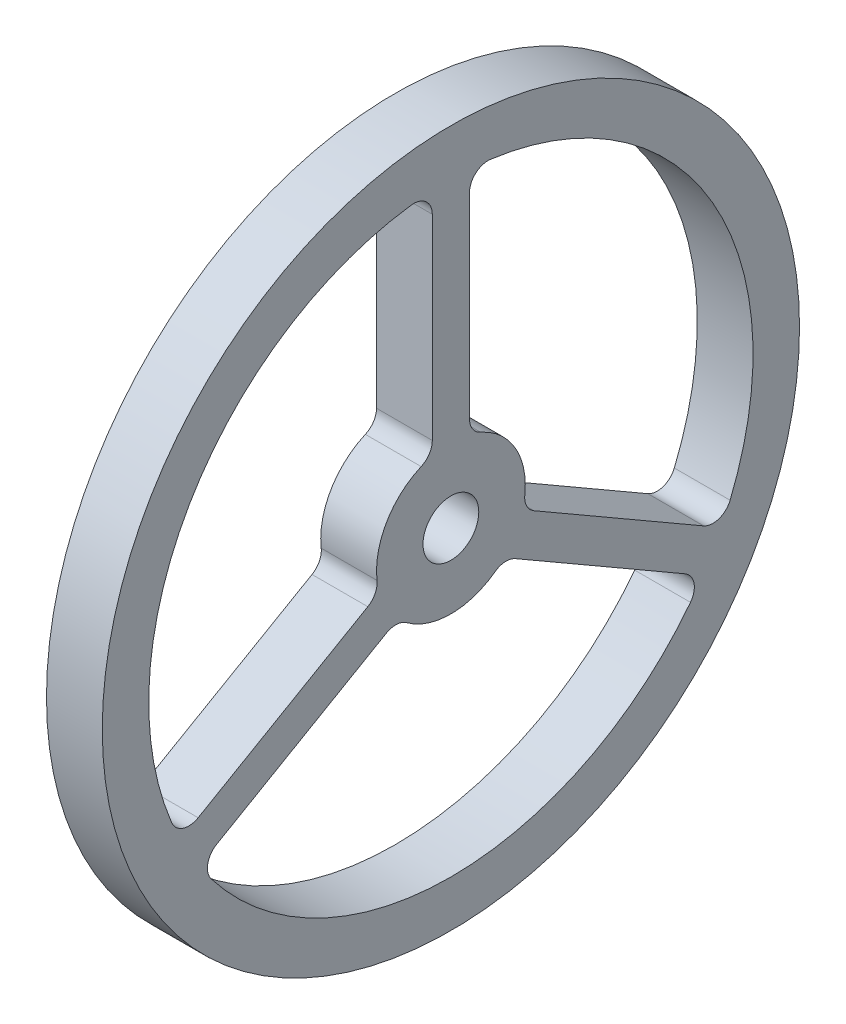
from build123d import *

# Parameters (mm, degrees)
SKETCH1_R           = 37.5
SKETCH1_R_2         = 3
BOSS_EXTRUDE1_DEPTH = 6
FILLET1_R           = 2


with BuildPart() as part:
    # Sketch1 → Boss-Extrude1 (new body)
    with BuildSketch(Plane(origin=(0, 0, 0), x_dir=(0, 0, -1), z_dir=(1, 0, 0))):
        Circle(SKETCH1_R)
        with BuildLine():
            ThreePointArc((-2, 7.745966692), (-6.92820323, 4), (-7.708203932, -2.140932539))
            Line((-7.708203932, -2.140932539), (-29.0924812, -14.487150776))
            ThreePointArc((-29.0924812, -14.487150776), (-28.145825623, 16.25), (-2, 32.438403167))
            Line((-2, 32.438403167), (-2, 7.745966692))
        make_face(mode=Mode.SUBTRACT)
        Circle(SKETCH1_R_2, mode=Mode.SUBTRACT)
        with BuildLine():
            ThreePointArc((-5.708203932, -5.605034154), (0, -8), (5.708203933, -5.605034154))
            Line((5.708203933, -5.605034154), (27.0924812, -17.951252391))
            ThreePointArc((27.0924812, -17.951252391), (0, -32.5), (-27.0924812, -17.951252391))
            Line((-27.0924812, -17.951252391), (-5.708203932, -5.605034154))
        make_face(mode=Mode.SUBTRACT)
        with BuildLine():
            ThreePointArc((7.708203933, -2.140932539), (6.92820323, 4), (2, 7.745966692))
            Line((2, 7.745966692), (2, 32.438403167))
            ThreePointArc((2, 32.438403167), (28.145825623, 16.25), (29.0924812, -14.487150776))
            Line((29.0924812, -14.487150776), (7.708203933, -2.140932539))
        make_face(mode=Mode.SUBTRACT)
    extrude(amount=BOSS_EXTRUDE1_DEPTH)

    # Fillet1
    fillet1_edges = [part.edges().sort_by_distance(p)[0] for p in [
        (3, 32.438403167, 2),
        (3, -14.487150776, 29.0924812),
        (3, -2.140932539, 7.708203932),
        (3, 7.745966692, 2),
        (3, -17.951252391, 27.0924812),
        (3, -17.951252391, -27.0924812),
        (3, -5.605034154, -5.708203933),
        (3, -5.605034154, 5.708203932),
        (3, -14.487150776, -29.0924812),
        (3, 32.438403167, -2),
        (3, 7.745966692, -2),
        (3, -2.140932539, -7.708203933),
    ]]
    fillet(fillet1_edges, radius=FILLET1_R)


solid = part.part
